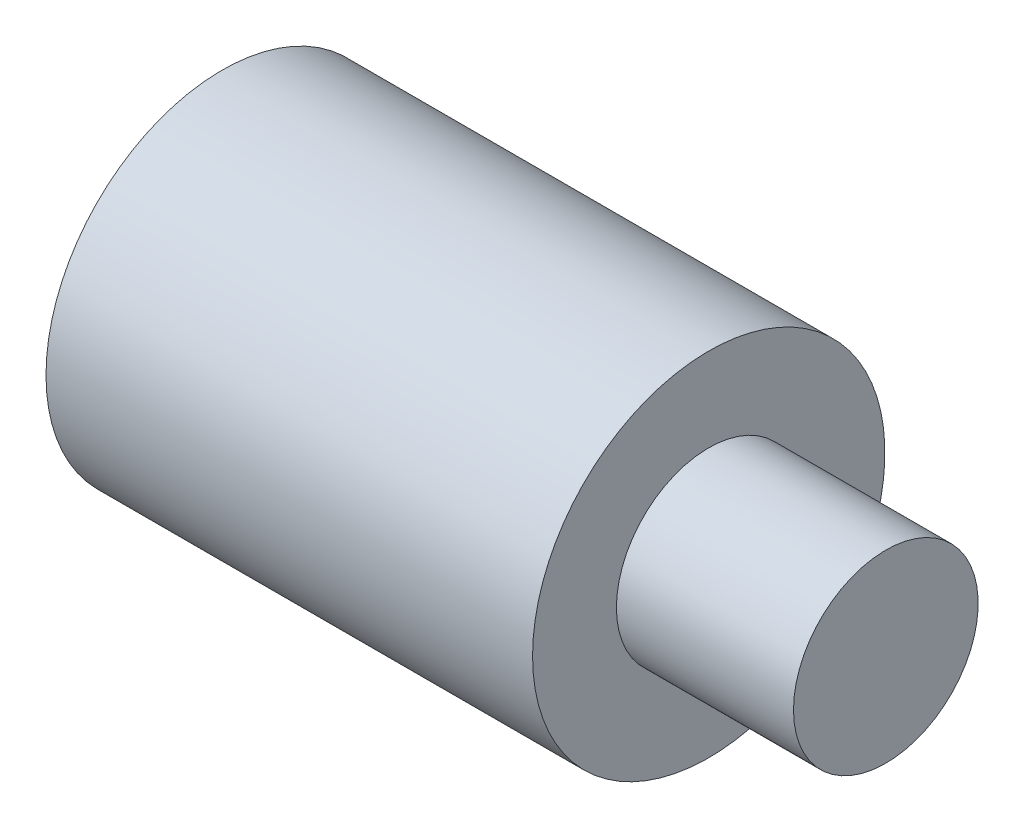
from build123d import *

# Parameters (mm, degrees)
SOCKET_SKETCH_W = 17.8
SOCKET_SKETCH_H = 4.7625


with BuildPart() as part:
    # Conn_T6_ORB4 Sketch → Conn_T6_ORB4 (revolve)
    with BuildSketch(Plane.XY):
        Polygon((9.5, 0), (9.5, 4.953), (0, 4.953), (0, 9.45), (-26.1, 9.45), (-26.1, 0), align=None)
    revolve(axis=Axis((-1000, 0, 0), (1, 0, 0)))

    # Socket Sketch → Socket (revolve, cut)
    with BuildSketch(Plane.XY):
        with Locations((-18.2, 2.38125)):
            Rectangle(SOCKET_SKETCH_W, SOCKET_SKETCH_H)
    revolve(axis=Axis((-1000, 0, 0), (1, 0, 0)), mode=Mode.SUBTRACT)


solid = part.part
